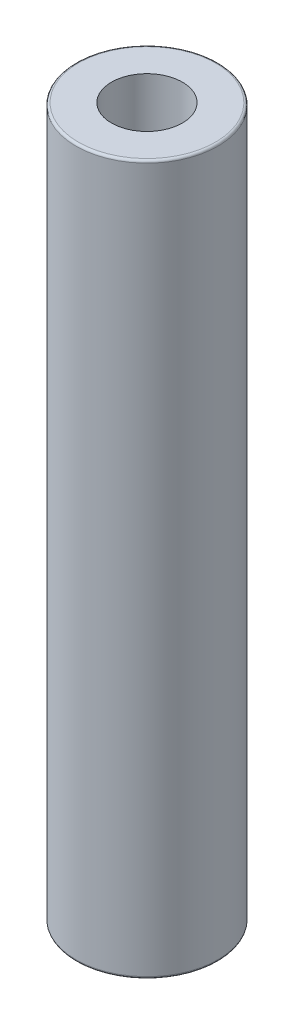
from build123d import *

# Parameters (mm, degrees)
SKETCH_1_R      = 3
SKETCH_1_R_2    = 1.5
EXTRUDE_1_DEPTH = 30
FILLET_1_R      = 0.1


with BuildPart() as part:
    # ｽｹｯﾁ1 → ﾎﾞｽ - 押し出し1 (new body)
    with BuildSketch(Plane(origin=(0, 0, 0), x_dir=(1, 0, 0), z_dir=(0, 1, 0))):
        with Locations(Location((0, 0, 0), (0, 0, 270))):
            Circle(SKETCH_1_R)
        with Locations(Location((0, 0, 0), (0, 0, 270))):
            Circle(SKETCH_1_R_2, mode=Mode.SUBTRACT)
    extrude(amount=EXTRUDE_1_DEPTH)

    # ﾌｨﾚｯﾄ1
    fillet_1_edges = [part.edges().sort_by_distance(p)[0] for p in [
        (0, 0, -3),
        (0, 30, -3),
    ]]
    fillet(fillet_1_edges, radius=FILLET_1_R)


solid = part.part
